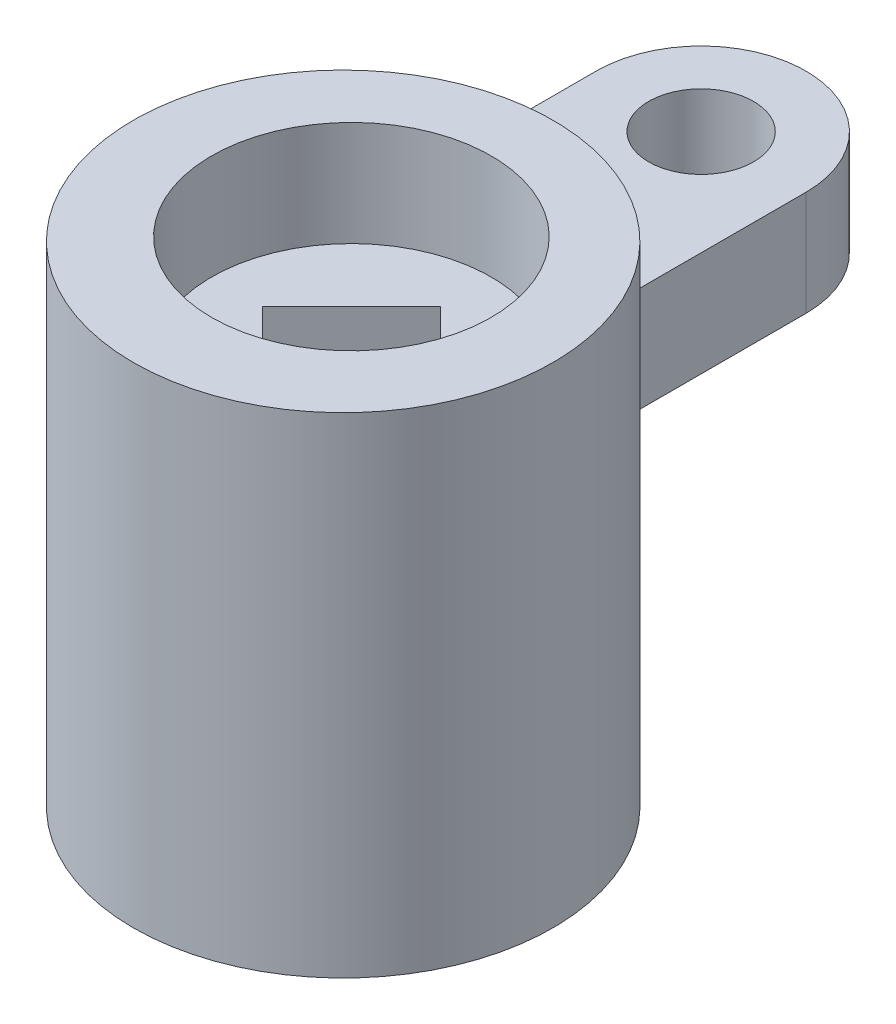
from build123d import *

# Parameters (mm, degrees)
SKETCH_2_R          = 30
EXTRUDE_1_DEPTH     = 70
SKETCH_3_R          = 20
CUT_EXTRUDE_2_DEPTH = 15
CUT_EXTRUDE_3_DEPTH = 55
EXTRUDE_START       = 43
EXTRUDE_2_DEPTH     = 15
SKETCH_7_R          = 7.5
CUT_EXTRUDE_4_DEPTH = 15


with BuildPart() as part:
    # 草图2 → 凸台-拉伸1 (new body)
    with BuildSketch(Plane(origin=(0, 0, 0), x_dir=(1, 0, 0), z_dir=(0, 1, 0))):
        with Locations(Location((0, -1.173457716, 0), (0, 0, 270))):
            Circle(SKETCH_2_R)
    extrude(amount=EXTRUDE_1_DEPTH)

    # 草图3 → 切除-拉伸2 (cut)
    with BuildSketch(Plane(origin=(0, 70, 0), x_dir=(1, 0, 0), z_dir=(0, 1, 0))):
        with Locations(Location((0, 0, 0), (0, 0, 270))):
            Circle(SKETCH_3_R)
    extrude(amount=-CUT_EXTRUDE_2_DEPTH, mode=Mode.SUBTRACT)

    # 草图5 → 切除-拉伸3 (cut)
    with BuildSketch(Plane.XZ):
        Polygon((0, 12.727922061), (12.727922061, 0), (0, -12.727922061), (-12.727922061, 0), align=None)
    extrude(amount=-CUT_EXTRUDE_3_DEPTH, mode=Mode.SUBTRACT)

    # 草图6 → 凸台-拉伸2 (add)
    with BuildSketch(Plane(origin=(0, 0, 0), x_dir=(1, 0, 0), z_dir=(0, 1, 0)).offset(EXTRUDE_START)):
        with BuildLine():
            Line((-15, 50), (-15, 24.807304398))
            ThreePointArc((-15, 24.807304398), (0, 28.826542284), (15, 24.807304398))
            Line((15, 24.807304398), (15, 50))
            ThreePointArc((15, 50), (0, 65), (-15, 50))
        make_face()
    extrude(amount=EXTRUDE_2_DEPTH)

    # 草图7 → 切除-拉伸4 (cut)
    with BuildSketch(Plane(origin=(0, 58, 0), x_dir=(1, 0, 0), z_dir=(0, 1, 0))):
        with Locations(Location((0, 50, 0), (0, 0, 270))):
            Circle(SKETCH_7_R)
    extrude(amount=-CUT_EXTRUDE_4_DEPTH, mode=Mode.SUBTRACT)


solid = part.part
